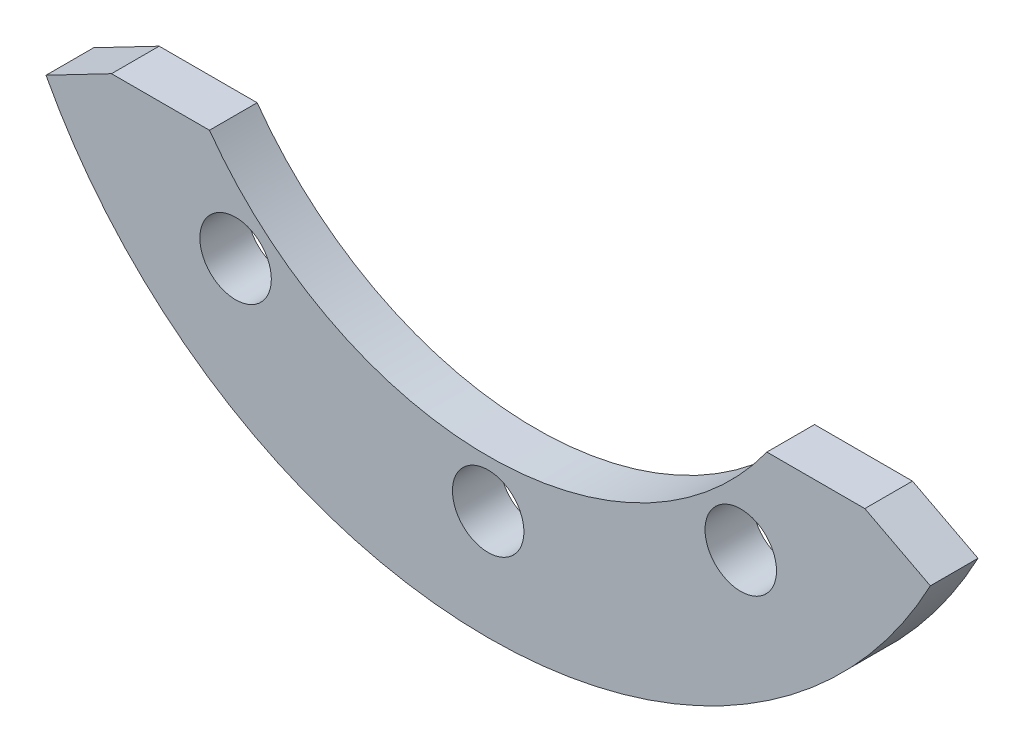
from build123d import *

# Parameters (mm, degrees)
BOSS_EXTRUDE1_DEPTH        = 1
F_1_5_1_5_DIAMETER_HOLE1_D = 1.5
CUT_EXTRUDE2_DEPTH         = 15.277955036


with BuildPart() as part:
    # Sketch1 → Boss-Extrude1 (new body)
    with BuildSketch(Plane.XY):
        with BuildLine():
            Line((-9.623408959, -4.2), (-5.848076607, -4.2))
            ThreePointArc((-5.848076607, -4.2), (0, -7.2), (5.848076607, -4.2))
            Line((5.848076607, -4.2), (9.623408959, -4.2))
            ThreePointArc((9.623408959, -4.2), (0, -10.5), (-9.623408959, -4.2))
        make_face()
    extrude(amount=-BOSS_EXTRUDE1_DEPTH)

    # Ø1.5 (1.5) Diameter Hole1 (through all)
    with Locations(Plane.XY):
        with Locations((0, -8.2), (-5.3, -6.256996084), (5.3, -6.256996084)):
            Hole(F_1_5_1_5_DIAMETER_HOLE1_D / 2)

    # Sketch2 → Cut-Extrude2 (cut, through all)
    with BuildSketch(Plane.XY):
        with BuildLine():
            Line((-7.903322086, -4.2), (-9.27823124, -4.915732403))
            ThreePointArc((-9.27823124, -4.915732403), (-9.457593181, -4.561132669), (-9.623408959, -4.2))
            Line((-9.623408959, -4.2), (-7.903322086, -4.2))
        make_face()
    cut_extrude2 = extrude(amount=-CUT_EXTRUDE2_DEPTH, mode=Mode.SUBTRACT)

    # Mirror1: Cut-Extrude2 across plane
    add(cut_extrude2.mirror(Plane(origin=(0, 0, 0), x_dir=(0, 0, 1), z_dir=(1, 0, 0))), mode=Mode.SUBTRACT)


solid = part.part
